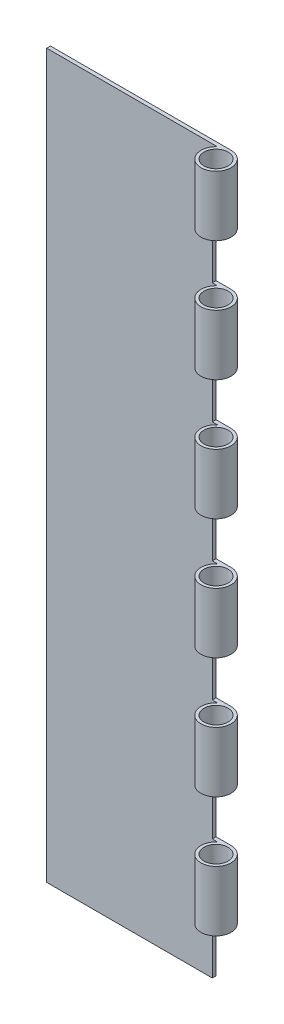
from build123d import *

# Parameters (mm, degrees)
SKETCH1_W               = 76.2
SKETCH1_H               = 304.8
BOSS_EXTRUDE1_DEPTH     = 1.5875
SKETCH2_R               = 6.35
BOSS_EXTRUDE2_DEPTH     = 304.8
CUT_EXTRUDE1_DEPTH      = 72.4535
CUT_EXTRUDE1_DEPTH_BACK = 72.4535
SKETCH3_W               = 22.233491501
SKETCH3_H               = 25.4
SKETCH3_W_2             = 25.169990379
SKETCH3_W_3             = 20.176908814
SKETCH4_R               = 5.08
CUT_EXTRUDE2_DEPTH      = 332.781682839


with BuildPart() as part:
    # Sketch1 → Boss-Extrude1 (new body)
    with BuildSketch(Plane.XY):
        with Locations((-92.340618933, 15.386782554)):
            Rectangle(SKETCH1_W, SKETCH1_H)
    extrude(amount=BOSS_EXTRUDE1_DEPTH)

    # Sketch2 → Boss-Extrude2 (add)
    with BuildSketch(Plane(origin=(0, 167.786782554, 0), x_dir=(1, 0, 0), z_dir=(0, 1, 0))):
        with Locations((-54.240618933, -6.35)):
            Circle(SKETCH2_R)
    extrude(amount=-BOSS_EXTRUDE2_DEPTH)

    # Sketch3 → Cut-Extrude1 (cut, two sides: drawn at the far end of the back side and taken through both)
    with BuildSketch(Plane.XY.offset(1.5875).offset(-CUT_EXTRUDE1_DEPTH_BACK)):
        with Locations((-49.473873183, 129.686782554)):
            Rectangle(SKETCH3_W, SKETCH3_H)
        with Locations((-49.473873183, 78.886782554)):
            Rectangle(SKETCH3_W, SKETCH3_H)
        with Locations((-49.473873183, 28.086782554)):
            Rectangle(SKETCH3_W, SKETCH3_H)
        with Locations((-49.473873183, -22.713217446)):
            Rectangle(SKETCH3_W, SKETCH3_H)
        with Locations((-48.005623744, -73.513217446)):
            Rectangle(SKETCH3_W_2, SKETCH3_H)
        with Locations((-50.502164526, -124.313217446)):
            Rectangle(SKETCH3_W_3, SKETCH3_H)
    extrude(amount=CUT_EXTRUDE1_DEPTH + CUT_EXTRUDE1_DEPTH_BACK, mode=Mode.SUBTRACT)

    # Sketch4 → Cut-Extrude2 (cut, through all)
    with BuildSketch(Plane(origin=(0, 167.786782554, 0), x_dir=(1, 0, 0), z_dir=(0, 1, 0))):
        with Locations(Location((-54.240618933, -6.35, 0), (0, 0, 270))):
            Circle(SKETCH4_R)
    extrude(amount=-CUT_EXTRUDE2_DEPTH, mode=Mode.SUBTRACT)


solid = part.part
